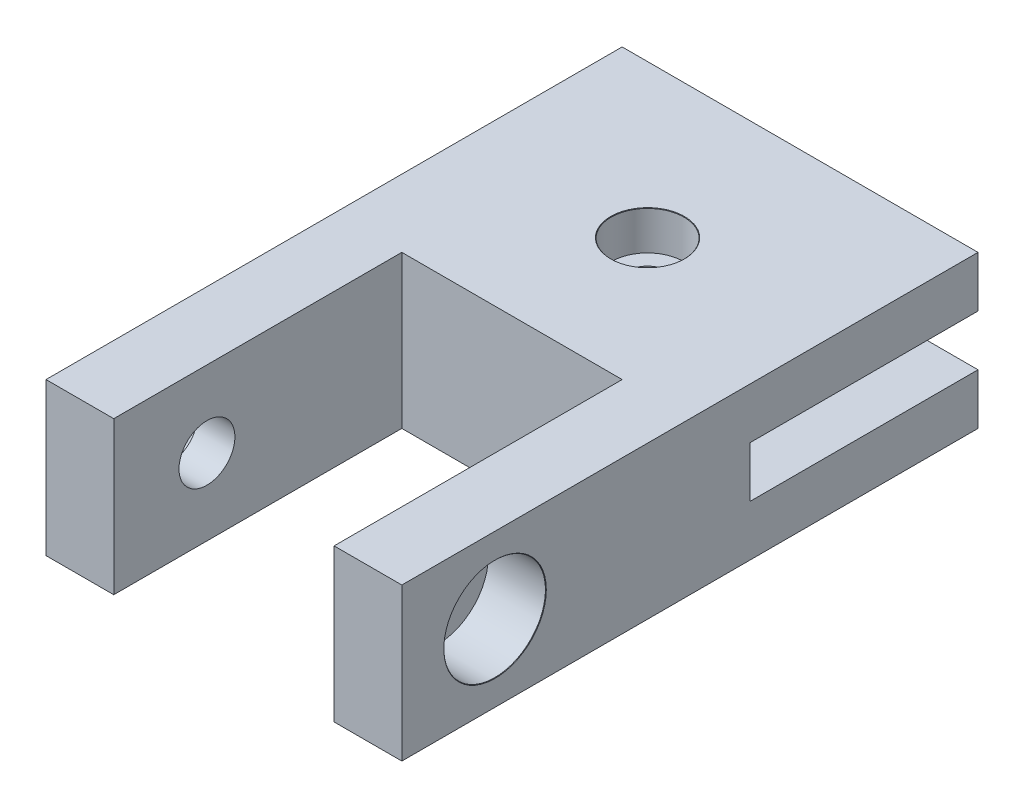
from build123d import *

# Parameters (mm, degrees)
SKETCH_1_W          = 21
SKETCH_1_H          = 34
EXTRUDE_1_DEPTH     = 9
SKETCH_6_W          = 13.003696042
SKETCH_6_H          = 17
CUT_EXTRUDE_3_DEPTH = 22.914607001
CUT_EXTRUDE_4_DEPTH = 1.8
CUT_EXTRUDE_5_REACH = 29.178
SKETCH_11_R         = 1.65
CUT_EXTRUDE_6_DEPTH = 3
CUT_EXTRUDE_7_REACH = 22.863
SKETCH_16_R         = 1.2
CUT_EXTRUDE_8_DEPTH = 1.8


with BuildPart() as part:
    # 草图1 → 凸台-拉伸1 (new body)
    with BuildSketch(Plane(origin=(0, 0, 0), x_dir=(1, 0, 0), z_dir=(0, 1, 0))):
        Rectangle(SKETCH_1_W, SKETCH_1_H)
    extrude(amount=EXTRUDE_1_DEPTH)

    # 草图6 → 切除-拉伸3 (cut, through all)
    with BuildSketch(Plane(origin=(0, 9, 0), x_dir=(1, 0, 0), z_dir=(0, 1, 0))):
        with Locations((0, -8.5)):
            Rectangle(SKETCH_6_W, SKETCH_6_H)
    extrude(amount=-CUT_EXTRUDE_3_DEPTH, mode=Mode.SUBTRACT)

    # 草图9 → M3 六角圆柱头螺钉的柱形沉头孔1 (revolve, cut)
    with BuildSketch(Plane(origin=(10.5, 4.5, 11.5), x_dir=(0, 0, -1), z_dir=(0, 1, 0))):
        Polygon((0, 0), (0, 3.998151979), (1.7, 3.998151979), (1.7, 3.4), (3, 3.4), (3, 0.025), (3.025, 0), align=None)
    revolve(axis=Axis((16.85, 4.5, 11.5), (-1, 0, 0)), mode=Mode.SUBTRACT)

    # 草图10 → 切除-拉伸4 (cut)
    with BuildSketch(Plane.ZY.offset(10.5)):
        Polygon((13.174315781, 1.6), (14.848631561, 4.5), (13.174315781, 7.4), (9.825684219, 7.4), (8.151368439, 4.5), (9.825684219, 1.6), align=None)
    extrude(amount=-CUT_EXTRUDE_4_DEPTH, mode=Mode.SUBTRACT)

    # 草图11 → 切除-拉伸5 (cut, up to next)
    with BuildSketch(Plane.ZY.offset(8.7), mode=Mode.PRIVATE) as cut_extrude_5_sk1:
        with Locations((11.5, 4.5)):
            Circle(SKETCH_11_R)
    cut_extrude_5_tool1 = extrude(cut_extrude_5_sk1.sketch, amount=-CUT_EXTRUDE_5_REACH, mode=Mode.PRIVATE) & part.part
    add(cut_extrude_5_tool1.solids().sort_by_distance((-8.7, 4.5, 11.5))[0], mode=Mode.SUBTRACT)

    # 草图12 → 切除-拉伸6 (cut)
    with BuildSketch(Plane(origin=(0, 3, 0), x_dir=(-1, 0, 0), z_dir=(0, -1, 0))):
        with BuildLine():
            Line((-10.5, 17), (10.5, 17))
            Line((10.5, 17), (10.5, 3.552777817))
            ThreePointArc((10.5, 3.552777817), (0, 3), (-10.5, 3.552777817))
            Line((-10.5, 3.552777817), (-10.5, 17))
        make_face()
    extrude(amount=-CUT_EXTRUDE_6_DEPTH, mode=Mode.SUBTRACT)

    # 草图15 → M2 六角圆柱头螺钉的柱形沉头孔1 (revolve, cut)
    with BuildSketch(Plane(origin=(0, 9, -8), x_dir=(0, 0, 1), z_dir=(1, 0, 0))):
        Polygon((0, 0), (0, 3), (1.2, 3), (1.2, 2.3), (2.15, 2.3), (2.15, 0.025), (2.175, 0), align=None)
    revolve(axis=Axis((0, 15.35, -8), (0, -1, 0)), mode=Mode.SUBTRACT)

    # 草图16 → 切除-拉伸7 (cut, up to next)
    with BuildSketch(Plane(origin=(0, 3, 0), x_dir=(1, 0, 0), z_dir=(0, 1, 0)), mode=Mode.PRIVATE) as cut_extrude_7_sk1:
        with Locations(Location((0, 8, 0), (0, 0, 270))):
            Circle(SKETCH_16_R)
    cut_extrude_7_tool1 = extrude(cut_extrude_7_sk1.sketch, amount=-CUT_EXTRUDE_7_REACH, mode=Mode.PRIVATE) & part.part
    add(cut_extrude_7_tool1.solids().sort_by_distance((0, 3, -8))[0], mode=Mode.SUBTRACT)

    # 草图17 → 切除-拉伸8 (cut)
    with BuildSketch(Plane.XZ):
        Polygon((1.212435565, -10.1), (2.424871131, -8), (1.212435565, -5.9), (-1.212435565, -5.9), (-2.424871131, -8), (-1.212435565, -10.1), align=None)
    extrude(amount=-CUT_EXTRUDE_8_DEPTH, mode=Mode.SUBTRACT)


solid = part.part
